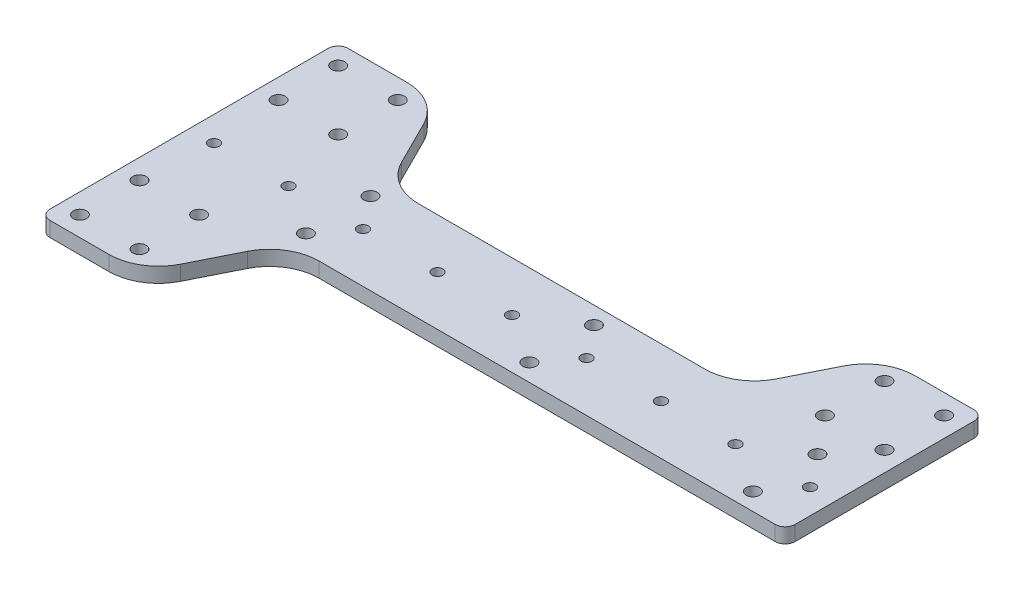
from build123d import *

# Parameters (mm, degrees)
EXTRUDE_1_DEPTH     = 3
SKETCH_2_R          = 1.35
CUT_EXTRUDE_1_DEPTH = 124.729543764
SKETCH_3_R          = 1.1
CUT_EXTRUDE_2_DEPTH = 124.729543764
EXTRUDE_2_DEPTH     = 3
FILLET_1_R          = 10
FILLET_2_R          = 2


with BuildPart() as part:
    # 草图1 → 凸台-拉伸1 (new body)
    with BuildSketch(Plane(origin=(0, 0, 0), x_dir=(1, 0, 0), z_dir=(0, 1, 0))):
        Polygon((10, 10), (10, 30), (-10, 30), (-10, -30), (10, -30), (10, -10), (120, -10), (120, 10), (120, 30), (100, 30), (100, 10), align=None)
    extrude(amount=EXTRUDE_1_DEPTH)

    # 草图2 → 切除-拉伸1 (cut, through all)
    with BuildSketch(Plane(origin=(0, 3, 0), x_dir=(1, 0, 0), z_dir=(0, 1, 0))):
        with Locations(Location((-6, 26, 0), (0, 0, 270))):
            Circle(SKETCH_2_R)
        with Locations(Location((-6, 14, 0), (0, 0, 90))):
            Circle(SKETCH_2_R)
        with Locations(Location((6, 14, 0), (0, 0, 270))):
            Circle(SKETCH_2_R)
        with Locations(Location((6, 26, 0), (0, 0, 90))):
            Circle(SKETCH_2_R)
        with Locations(Location((6, -26, 0), (0, 0, 270))):
            Circle(SKETCH_2_R)
        with Locations(Location((6, -14, 0), (0, 0, 90))):
            Circle(SKETCH_2_R)
        with Locations(Location((-6, -14, 0), (0, 0, 270))):
            Circle(SKETCH_2_R)
        with Locations(Location((-6, -26, 0), (0, 0, 90))):
            Circle(SKETCH_2_R)
        with Locations(Location((110, 6.5, 0), (0, 0, 270))):
            Circle(SKETCH_2_R)
        with Locations(Location((20, 6.5, 0), (0, 0, 90))):
            Circle(SKETCH_2_R)
        with Locations(Location((65, 6.5, 0), (0, 0, 270))):
            Circle(SKETCH_2_R)
        with Locations(Location((65, -6.5, 0), (0, 0, 90))):
            Circle(SKETCH_2_R)
        with Locations(Location((20, -6.5, 0), (0, 0, 270))):
            Circle(SKETCH_2_R)
        with Locations(Location((110, -6.5, 0), (0, 0, 90))):
            Circle(SKETCH_2_R)
        with Locations(Location((104, 26, 0), (0, 0, 270))):
            Circle(SKETCH_2_R)
        with Locations(Location((104, 14, 0), (0, 0, 90))):
            Circle(SKETCH_2_R)
        with Locations(Location((116, 14, 0), (0, 0, 270))):
            Circle(SKETCH_2_R)
        with Locations(Location((116, 26, 0), (0, 0, 90))):
            Circle(SKETCH_2_R)
    extrude(amount=-CUT_EXTRUDE_1_DEPTH, mode=Mode.SUBTRACT)

    # 草图3 → 切除-拉伸2 (cut, through all)
    with BuildSketch(Plane(origin=(0, 3, 0), x_dir=(1, 0, 0), z_dir=(0, 1, 0))):
        with Locations(Location((115, 0, 0), (0, 0, 270))):
            Circle(SKETCH_3_R)
        with Locations(Location((100, 0, 0), (0, 0, 270))):
            Circle(SKETCH_3_R)
        with Locations(Location((85, 0, 0), (0, 0, 270))):
            Circle(SKETCH_3_R)
        with Locations(Location((70, 0, 0), (0, 0, 270))):
            Circle(SKETCH_3_R)
        with Locations(Location((55, 0, 0), (0, 0, 270))):
            Circle(SKETCH_3_R)
        with Locations(Location((40, 0, 0), (0, 0, 270))):
            Circle(SKETCH_3_R)
        with Locations(Location((25, 0, 0), (0, 0, 270))):
            Circle(SKETCH_3_R)
        with Locations(Location((10, 0, 0), (0, 0, 270))):
            Circle(SKETCH_3_R)
        with Locations(Location((-5, 0, 0), (0, 0, 270))):
            Circle(SKETCH_3_R)
    extrude(amount=-CUT_EXTRUDE_2_DEPTH, mode=Mode.SUBTRACT)

    # 草图4 → 凸台-拉伸2 (add)
    with BuildSketch(Plane(origin=(0, 3, 0), x_dir=(1, 0, 0), z_dir=(0, 1, 0))):
        Polygon((10, -30), (20, -10), (10, -10), align=None)
        Polygon((20, 10), (10, 10), (10, 30), align=None)
        Polygon((100, 30), (90, 10), (100, 10), align=None)
    extrude(amount=-EXTRUDE_2_DEPTH)

    # 圆角1
    fillet_1_edges = [part.edges().sort_by_distance(p)[0] for p in [
        (20, 1.5, -10),
        (20, 1.5, 10),
        (90, 1.5, -10),
        (10, 1.5, -30),
        (100, 1.5, -30),
        (10, 1.5, 30),
    ]]
    fillet(fillet_1_edges, radius=FILLET_1_R)

    # 圆角2
    fillet_2_edges = [part.edges().sort_by_distance(p)[0] for p in [
        (120, 1.5, -30),
        (120, 1.5, 10),
        (-10, 1.5, 30),
        (-10, 1.5, -30),
    ]]
    fillet(fillet_2_edges, radius=FILLET_2_R)


solid = part.part
